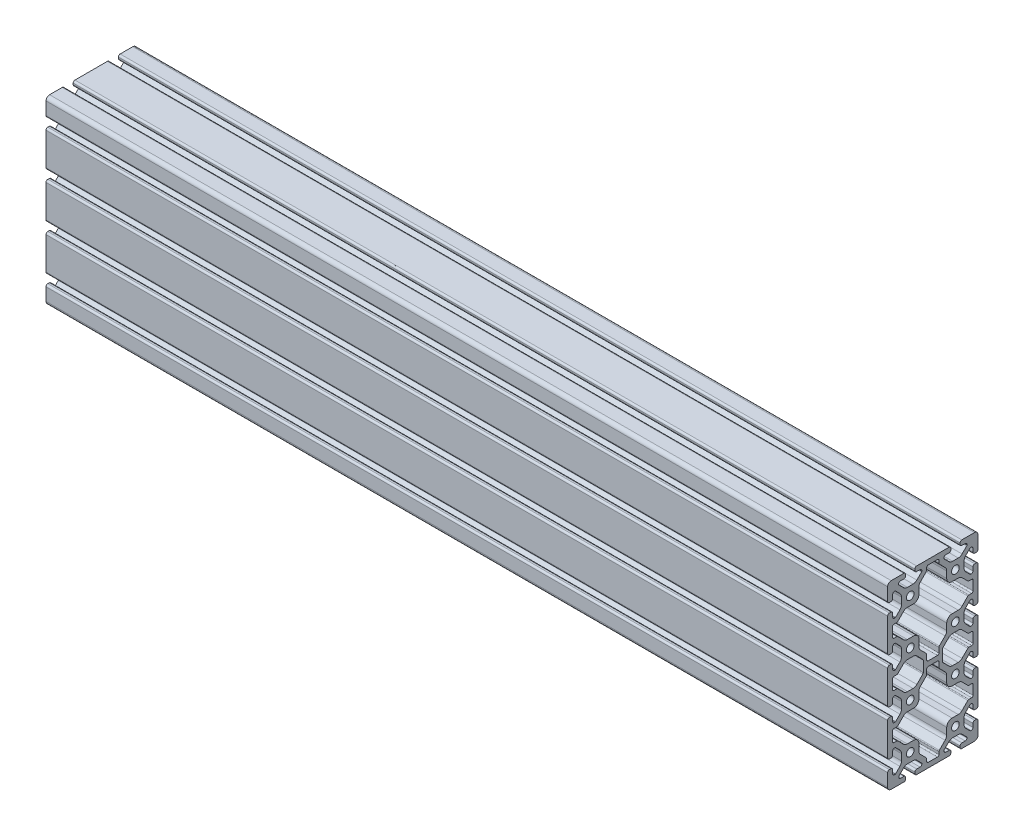
from build123d import *

# Parameters (mm, degrees)
SKETCH13_R              = 3.4
ALUMINUM_80X160_1_DEPTH = 745


with BuildPart() as part:
    # Sketch13 → Aluminum 80X160(1) (new body)
    with BuildSketch(Plane(origin=(0, 0, 0), x_dir=(0, 0, -1), z_dir=(1, 0, 0))):
        with BuildLine():
            Line((18.430000001, 115.93999946), (17.094615035, 115.93999946))
            ThreePointArc((17.094615035, 115.93999946), (15.984457388, 115.480157107), (15.524615035, 114.36999946))
            Line((15.524615035, 114.36999946), (15.524615035, 111.28499946))
            ThreePointArc((15.524615035, 111.28499946), (15.064772681, 110.174841814), (13.954615035, 109.71499946))
            Line((13.954615035, 109.71499946), (13.492503603, 109.71499946))
            ThreePointArc((13.492503603, 109.71499946), (13.201664018, 109.772851089), (12.955102179, 109.937598577))
            Line((12.955102179, 109.937598577), (9.109794089, 113.782907207))
            ThreePointArc((9.109794089, 113.782907207), (8.05529192, 115.36108123), (7.685000001, 117.222664418))
            Line((7.685000001, 117.222664418), (7.685000001, 122.777335582))
            ThreePointArc((7.685000001, 122.777335582), (8.05529192, 124.63891877), (9.109794089, 126.217092793))
            Line((9.109794089, 126.217092793), (12.955099454, 130.062404149))
            ThreePointArc((12.955099454, 130.062404149), (13.201662574, 130.227152355), (13.492503603, 130.285004232))
            Line((13.492503603, 130.285004232), (13.954615035, 130.285004232))
            ThreePointArc((13.954615035, 130.285004232), (15.064772681, 129.825161878), (15.524615035, 128.715004232))
            Line((15.524615035, 128.715004232), (15.524615035, 125.630004232))
            ThreePointArc((15.524615035, 125.630004232), (15.984457388, 124.519846585), (17.094615035, 124.060004232))
            Line((17.094615035, 124.060004232), (18.430000001, 124.060004232))
            ThreePointArc((18.430000001, 124.060004232), (19.540157647, 124.519846585), (20.000000001, 125.630004232))
            Line((20.000000001, 125.630004232), (20.000000001, 136.830003701))
            ThreePointArc((20.000000001, 136.830003701), (19.0715285, 139.07153219), (16.830000011, 140.000003691))
            Line((16.830000011, 140.000003691), (5.630000542, 140.000003691))
            ThreePointArc((5.630000542, 140.000003691), (4.519842916, 139.540161346), (4.060000572, 138.43000372))
            Line((4.060000572, 138.43000372), (4.060000572, 137.24999997))
            ThreePointArc((4.060000572, 137.24999997), (4.519842916, 136.139842345), (5.630000542, 135.68))
            Line((5.630000542, 135.68), (8.715399492, 135.68))
            ThreePointArc((8.715399492, 135.68), (9.825557139, 135.220157646), (10.285399492, 134.11))
            Line((10.285399492, 134.11), (10.285399492, 133.6200547))
            ThreePointArc((10.285399492, 133.6200547), (10.160433474, 133.35903797), (9.946956002, 133.163657296))
            Line((9.946956002, 133.163657296), (5.859541495, 129.076242789))
            ThreePointArc((5.859541495, 129.076242789), (4.318530588, 128.04657222), (2.500784284, 127.685))
            Line((2.500784284, 127.685), (-2.500784284, 127.685))
            ThreePointArc((-2.500784284, 127.685), (-4.318530588, 128.04657222), (-5.859541495, 129.076242789))
            Line((-5.859541495, 129.076242789), (-10.062800646, 133.27950194))
            ThreePointArc((-10.062800646, 133.27950194), (-10.227547937, 133.526063686), (-10.285399492, 133.816903094))
            Line((-10.285399492, 133.816903094), (-10.285398948, 134.11))
            ThreePointArc((-10.285398948, 134.11), (-9.825556595, 135.220157646), (-8.715398948, 135.68))
            Line((-8.715398948, 135.68), (-5.629999998, 135.68))
            ThreePointArc((-5.629999998, 135.68), (-4.519842372, 136.139842345), (-4.060000027, 137.24999997))
            Line((-4.060000027, 137.24999997), (-4.060000027, 138.43000372))
            ThreePointArc((-4.060000027, 138.43000372), (-4.519842372, 139.540161346), (-5.629999998, 140.000003691))
            Line((-5.629999998, 140.000003691), (-34.369999458, 140.000003691))
            ThreePointArc((-34.369999458, 140.000003691), (-35.480157084, 139.540161346), (-35.939999428, 138.43000372))
            Line((-35.939999428, 138.43000372), (-35.939999428, 137.24999997))
            ThreePointArc((-35.939999428, 137.24999997), (-35.480157084, 136.139842345), (-34.369999458, 135.68))
            Line((-34.369999458, 135.68), (-31.284600508, 135.68))
            ThreePointArc((-31.284600508, 135.68), (-30.174442861, 135.220157646), (-29.714600508, 134.11))
            Line((-29.714600508, 134.11), (-29.714600508, 133.6200547))
            ThreePointArc((-29.714600508, 133.6200547), (-29.839566526, 133.35903797), (-30.053043999, 133.163657296))
            Line((-30.053043999, 133.163657296), (-34.140458506, 129.076242789))
            ThreePointArc((-34.140458506, 129.076242789), (-35.681469413, 128.04657222), (-37.499215716, 127.685))
            Line((-37.499215716, 127.685), (-42.500784283, 127.685))
            ThreePointArc((-42.500784283, 127.685), (-44.318530587, 128.04657222), (-45.859541494, 129.076242789))
            Line((-45.859541494, 129.076242789), (-50.062800921, 133.279501665))
            ThreePointArc((-50.062800921, 133.279501665), (-50.227548408, 133.526063507), (-50.285400035, 133.816903094))
            Line((-50.285400035, 133.816903094), (-50.285399491, 134.11))
            ThreePointArc((-50.285399491, 134.11), (-49.825557138, 135.220157646), (-48.715399491, 135.68))
            Line((-48.715399491, 135.68), (-45.630000541, 135.68))
            ThreePointArc((-45.630000541, 135.68), (-44.519842915, 136.139842345), (-44.06000057, 137.24999997))
            Line((-44.06000057, 137.24999997), (-44.06000057, 138.43000372))
            ThreePointArc((-44.06000057, 138.43000372), (-44.519842915, 139.540161346), (-45.630000541, 140.000003691))
            Line((-45.630000541, 140.000003691), (-56.83000001, 140.000003691))
            ThreePointArc((-56.83000001, 140.000003691), (-59.071528499, 139.07153219), (-60, 136.830003701))
            Line((-60, 136.830003701), (-60, 125.630004232))
            ThreePointArc((-60, 125.630004232), (-59.540157646, 124.519846585), (-58.43, 124.060004232))
            Line((-58.43, 124.060004232), (-57.094615034, 124.060004232))
            ThreePointArc((-57.094615034, 124.060004232), (-55.984457387, 124.519846585), (-55.524615034, 125.630004232))
            Line((-55.524615034, 125.630004232), (-55.524615034, 128.715004232))
            ThreePointArc((-55.524615034, 128.715004232), (-55.06477268, 129.825161878), (-53.954615034, 130.285004232))
            Line((-53.954615034, 130.285004232), (-53.492503602, 130.285004232))
            ThreePointArc((-53.492503602, 130.285004232), (-53.201662569, 130.227152353), (-52.955099446, 130.062404142))
            Line((-52.955099446, 130.062404142), (-49.109794081, 126.217092786))
            ThreePointArc((-49.109794081, 126.217092786), (-48.055291917, 124.638918766), (-47.685, 122.777335582))
            Line((-47.685, 122.777335582), (-47.685, 117.222664418))
            ThreePointArc((-47.685, 117.222664418), (-48.055291992, 115.361081053), (-49.109794358, 113.782906937))
            Line((-49.109794358, 113.782906937), (-52.955102448, 109.937598306))
            ThreePointArc((-52.955102448, 109.937598306), (-53.201664193, 109.772851015), (-53.492503602, 109.71499946))
            Line((-53.492503602, 109.71499946), (-53.954615034, 109.71499946))
            ThreePointArc((-53.954615034, 109.71499946), (-55.06477268, 110.174841814), (-55.524615034, 111.28499946))
            Line((-55.524615034, 111.28499946), (-55.524615034, 114.36999946))
            ThreePointArc((-55.524615034, 114.36999946), (-55.984457387, 115.480157107), (-57.094615034, 115.93999946))
            Line((-57.094615034, 115.93999946), (-58.43, 115.93999946))
            ThreePointArc((-58.43, 115.93999946), (-59.540157646, 115.480157107), (-60, 114.36999946))
            Line((-60, 114.36999946), (-60, 85.63))
            ThreePointArc((-60, 85.63), (-59.540157646, 84.519842353), (-58.43, 84.06))
            Line((-58.43, 84.06), (-57.094615034, 84.06))
            ThreePointArc((-57.094615034, 84.06), (-55.984457387, 84.519842353), (-55.524615034, 85.63))
            Line((-55.524615034, 85.63), (-55.524615034, 88.715))
            ThreePointArc((-55.524615034, 88.715), (-55.06477268, 89.825157646), (-53.954615034, 90.285))
            Line((-53.954615034, 90.285), (-53.492503602, 90.285))
            ThreePointArc((-53.492503602, 90.285), (-53.201664193, 90.227148444), (-52.955102448, 90.062401153))
            Line((-52.955102448, 90.062401153), (-49.109794088, 86.217092793))
            ThreePointArc((-49.109794088, 86.217092793), (-48.055291919, 84.63891877), (-47.685, 82.777335582))
            Line((-47.685, 82.777335582), (-47.685, 77.222664417))
            ThreePointArc((-47.685, 77.222664417), (-48.055291919, 75.361081229), (-49.109794088, 73.782907207))
            Line((-49.109794088, 73.782907207), (-52.955102448, 69.937598846))
            ThreePointArc((-52.955102448, 69.937598846), (-53.201664193, 69.772851555), (-53.492503602, 69.715))
            Line((-53.492503602, 69.715), (-53.954615034, 69.715))
            ThreePointArc((-53.954615034, 69.715), (-55.06477268, 70.174842354), (-55.524615034, 71.285))
            Line((-55.524615034, 71.285), (-55.524615034, 74.37))
            ThreePointArc((-55.524615034, 74.37), (-55.984457387, 75.480157646), (-57.094615034, 75.94))
            Line((-57.094615034, 75.94), (-58.43, 75.94))
            ThreePointArc((-58.43, 75.94), (-59.540157646, 75.480157646), (-60, 74.37))
            Line((-60, 74.37), (-60, 45.63000054))
            ThreePointArc((-60, 45.63000054), (-59.540157646, 44.519842893), (-58.43, 44.06000054))
            Line((-58.43, 44.06000054), (-57.094615034, 44.06000054))
            ThreePointArc((-57.094615034, 44.06000054), (-55.984457387, 44.519842893), (-55.524615034, 45.63000054))
            Line((-55.524615034, 45.63000054), (-55.524615034, 48.715000539))
            ThreePointArc((-55.524615034, 48.715000539), (-55.06477268, 49.825158186), (-53.954615034, 50.285000539))
            Line((-53.954615034, 50.285000539), (-53.492503602, 50.285000539))
            ThreePointArc((-53.492503602, 50.285000539), (-53.201663987, 50.227148943), (-52.955102067, 50.062401535))
            Line((-52.955102067, 50.062401535), (-49.109794088, 46.217092793))
            ThreePointArc((-49.109794088, 46.217092793), (-48.055291919, 44.63891877), (-47.685, 42.777335582))
            Line((-47.685, 42.777335582), (-47.685, 37.222664417))
            ThreePointArc((-47.685, 37.222664417), (-48.055291919, 35.361081229), (-49.109794088, 33.782907206))
            Line((-49.109794088, 33.782907206), (-52.955102448, 29.937598846))
            ThreePointArc((-52.955102448, 29.937598846), (-53.201664193, 29.772851555), (-53.492503602, 29.715))
            Line((-53.492503602, 29.715), (-53.954615034, 29.715))
            ThreePointArc((-53.954615034, 29.715), (-55.06477268, 30.174842353), (-55.524615034, 31.285))
            Line((-55.524615034, 31.285), (-55.524615034, 34.37))
            ThreePointArc((-55.524615034, 34.37), (-55.984457387, 35.480157646), (-57.094615034, 35.94))
            Line((-57.094615034, 35.94), (-58.43, 35.94))
            ThreePointArc((-58.43, 35.94), (-59.540157646, 35.480157646), (-60, 34.37))
            Line((-60, 34.37), (-60, 5.630000539))
            ThreePointArc((-60, 5.630000539), (-59.540157646, 4.519842893), (-58.43, 4.060000539))
            Line((-58.43, 4.060000539), (-57.094615034, 4.060000539))
            ThreePointArc((-57.094615034, 4.060000539), (-55.984457387, 4.519842893), (-55.524615034, 5.630000539))
            Line((-55.524615034, 5.630000539), (-55.524615034, 8.715000539))
            ThreePointArc((-55.524615034, 8.715000539), (-55.06477268, 9.825158186), (-53.954615034, 10.285000539))
            Line((-53.954615034, 10.285000539), (-53.492503602, 10.285000539))
            ThreePointArc((-53.492503602, 10.285000539), (-53.201662345, 10.227148616), (-52.955099032, 10.062400278))
            Line((-52.955099032, 10.062400278), (-49.109791942, 6.217090648))
            ThreePointArc((-49.109791942, 6.217090648), (-48.055291338, 4.638917369), (-47.685, 2.777335582))
            Line((-47.685, 2.777335582), (-47.685, -2.777335582))
            ThreePointArc((-47.685, -2.777335582), (-48.055292499, -4.638920172), (-49.109796234, -6.217094939))
            Line((-49.109796234, -6.217094939), (-52.955102448, -10.062405445))
            ThreePointArc((-52.955102448, -10.062405445), (-53.201664193, -10.227152736), (-53.492503602, -10.285004291))
            Line((-53.492503602, -10.285004291), (-53.954615034, -10.285004291))
            ThreePointArc((-53.954615034, -10.285004291), (-55.06477268, -9.825161938), (-55.524615034, -8.715004291))
            Line((-55.524615034, -8.715004291), (-55.524615034, -5.630004291))
            ThreePointArc((-55.524615034, -5.630004291), (-55.984457387, -4.519846645), (-57.094615034, -4.060004291))
            Line((-57.094615034, -4.060004291), (-58.43, -4.060004291))
            ThreePointArc((-58.43, -4.060004291), (-59.540157646, -4.519846645), (-60, -5.630004291))
            Line((-60, -5.630004291), (-60, -16.83000376))
            ThreePointArc((-60, -16.83000376), (-59.071528499, -19.07153225), (-56.83000001, -20.00000375))
            Line((-56.83000001, -20.00000375), (-45.572979047, -20.00000375))
            ThreePointArc((-45.572979047, -20.00000375), (-44.4628214, -19.540161397), (-44.002979047, -18.43000375))
            Line((-44.002979047, -18.43000375), (-44.002979047, -17.25))
            ThreePointArc((-44.002979047, -17.25), (-44.4628214, -16.139842354), (-45.572979047, -15.68))
            Line((-45.572979047, -15.68), (-48.475666995, -15.68))
            ThreePointArc((-48.475666995, -15.68), (-49.605030481, -15.200613642), (-50.044710593, -14.05520779))
            Line((-50.044710593, -14.05520779), (-50.033001359, -13.71989919))
            ThreePointArc((-50.033001359, -13.71989919), (-50.01272935, -13.354224617), (-49.823787839, -13.040489134))
            Line((-49.823787839, -13.040489134), (-45.859541494, -9.076242789))
            ThreePointArc((-45.859541494, -9.076242789), (-44.318530587, -8.046572221), (-42.500784283, -7.685))
            Line((-42.500784283, -7.685), (-37.499215716, -7.685))
            ThreePointArc((-37.499215716, -7.685), (-35.681469412, -8.046572221), (-34.140458505, -9.076242789))
            Line((-34.140458505, -9.076242789), (-29.937199354, -13.279501941))
            ThreePointArc((-29.937199354, -13.279501941), (-29.772452063, -13.526063686), (-29.714600508, -13.816903094))
            Line((-29.714600508, -13.816903094), (-29.714600508, -14.11))
            ThreePointArc((-29.714600508, -14.11), (-30.174442861, -15.220157647), (-31.284600508, -15.68))
            Line((-31.284600508, -15.68), (-34.242079997, -15.68))
            ThreePointArc((-34.242079997, -15.68), (-35.396115236, -16.115290279), (-35.879549627, -17.25))
            Line((-35.879549627, -17.25), (-35.879549627, -18.43000375))
            ThreePointArc((-35.879549627, -18.43000375), (-35.396115236, -19.564713471), (-34.242079997, -20.00000375))
            Line((-34.242079997, -20.00000375), (-5.572979047, -20.00000375))
            ThreePointArc((-5.572979047, -20.00000375), (-4.4628214, -19.540161397), (-4.002979047, -18.43000375))
            Line((-4.002979047, -18.43000375), (-4.002979047, -17.25))
            ThreePointArc((-4.002979047, -17.25), (-4.4628214, -16.139842354), (-5.572979047, -15.68))
            Line((-5.572979047, -15.68), (-8.475666995, -15.68))
            ThreePointArc((-8.475666995, -15.68), (-9.605030481, -15.200613642), (-10.044710593, -14.05520779))
            Line((-10.044710593, -14.05520779), (-10.033001359, -13.71989919))
            ThreePointArc((-10.033001359, -13.71989919), (-10.01272935, -13.354224617), (-9.823787839, -13.040489134))
            Line((-9.823787839, -13.040489134), (-5.859541494, -9.076242789))
            ThreePointArc((-5.859541494, -9.076242789), (-4.318530587, -8.046572221), (-2.500784283, -7.685))
            Line((-2.500784283, -7.685), (2.500784284, -7.685))
            ThreePointArc((2.500784284, -7.685), (4.318530588, -8.046572221), (5.859541495, -9.076242789))
            Line((5.859541495, -9.076242789), (10.062800646, -13.279501941))
            ThreePointArc((10.062800646, -13.279501941), (10.227547937, -13.526063686), (10.285399492, -13.816903094))
            Line((10.285399492, -13.816903094), (10.285399492, -14.11))
            ThreePointArc((10.285399492, -14.11), (9.825557139, -15.220157647), (8.715399492, -15.68))
            Line((8.715399492, -15.68), (5.757920003, -15.68))
            ThreePointArc((5.757920003, -15.68), (4.604217926, -16.116685586), (4.12044985, -17.251450422))
            Line((4.12044985, -17.251450422), (4.12044985, -18.431454172))
            ThreePointArc((4.12044985, -18.431454172), (4.604408447, -19.565215201), (5.757920003, -20.00000375))
            Line((5.757920003, -20.00000375), (17.018369329, -20.00000375))
            ThreePointArc((17.018369329, -20.00000375), (19.194276186, -18.951580404), (20.000000001, -16.674615034))
            Line((20.000000001, -16.674615034), (20.000000001, -5.630004291))
            ThreePointArc((20.000000001, -5.630004291), (19.540157647, -4.519846645), (18.430000001, -4.060004291))
            Line((18.430000001, -4.060004291), (17.094615035, -4.060004291))
            ThreePointArc((17.094615035, -4.060004291), (15.984457388, -4.519846645), (15.524615035, -5.630004291))
            Line((15.524615035, -5.630004291), (15.524615035, -8.715004291))
            ThreePointArc((15.524615035, -8.715004291), (15.064772681, -9.825161938), (13.954615035, -10.285004291))
            Line((13.954615035, -10.285004291), (13.492503603, -10.285004291))
            ThreePointArc((13.492503603, -10.285004291), (13.201662793, -10.227152155), (12.955100304, -10.062403299))
            Line((12.955100304, -10.062403299), (9.109794089, -6.217092793))
            ThreePointArc((9.109794089, -6.217092793), (8.05529192, -4.63891877), (7.685000001, -2.777335582))
            Line((7.685000001, -2.777335582), (7.685000001, 2.777335582))
            ThreePointArc((7.685000001, 2.777335582), (8.05529192, 4.63891877), (9.109794089, 6.217092793))
            Line((9.109794089, 6.217092793), (12.955101179, 10.062402423))
            ThreePointArc((12.955101179, 10.062402423), (13.201663747, 10.227149197), (13.492503603, 10.285000539))
            Line((13.492503603, 10.285000539), (13.954615035, 10.285000539))
            ThreePointArc((13.954615035, 10.285000539), (15.064772681, 9.825158186), (15.524615035, 8.715000539))
            Line((15.524615035, 8.715000539), (15.524615035, 5.630000539))
            ThreePointArc((15.524615035, 5.630000539), (15.984457388, 4.519842893), (17.094615035, 4.060000539))
            Line((17.094615035, 4.060000539), (18.430000001, 4.060000539))
            ThreePointArc((18.430000001, 4.060000539), (19.540157647, 4.519842893), (20.000000001, 5.630000539))
            Line((20.000000001, 5.630000539), (20.000000001, 34.37))
            ThreePointArc((20.000000001, 34.37), (19.540157647, 35.480157646), (18.430000001, 35.94))
            Line((18.430000001, 35.94), (17.094615035, 35.94))
            ThreePointArc((17.094615035, 35.94), (15.984457388, 35.480157646), (15.524615035, 34.37))
            Line((15.524615035, 34.37), (15.524615035, 31.285))
            ThreePointArc((15.524615035, 31.285), (15.064772681, 30.174842353), (13.954615035, 29.715))
            Line((13.954615035, 29.715), (13.492503603, 29.715))
            ThreePointArc((13.492503603, 29.715), (13.201664194, 29.772851555), (12.955102449, 29.937598846))
            Line((12.955102449, 29.937598846), (9.109794089, 33.782907206))
            ThreePointArc((9.109794089, 33.782907206), (8.05529192, 35.361081229), (7.685000001, 37.222664417))
            Line((7.685000001, 37.222664417), (7.685000001, 42.777335582))
            ThreePointArc((7.685000001, 42.777335582), (8.05529192, 44.638918771), (9.109794089, 46.217092794))
            Line((9.109794089, 46.217092794), (12.955102068, 50.062401536))
            ThreePointArc((12.955102068, 50.062401536), (13.201663988, 50.227148943), (13.492503603, 50.285000539))
            Line((13.492503603, 50.285000539), (13.954615035, 50.285000539))
            ThreePointArc((13.954615035, 50.285000539), (15.064772681, 49.825158186), (15.524615035, 48.715000539))
            Line((15.524615035, 48.715000539), (15.524615035, 45.63000054))
            ThreePointArc((15.524615035, 45.63000054), (15.984457388, 44.519842893), (17.094615035, 44.06000054))
            Line((17.094615035, 44.06000054), (18.430000001, 44.06000054))
            ThreePointArc((18.430000001, 44.06000054), (19.540157647, 44.519842893), (20.000000001, 45.63000054))
            Line((20.000000001, 45.63000054), (20.000000001, 74.37))
            ThreePointArc((20.000000001, 74.37), (19.540157647, 75.480157646), (18.430000001, 75.94))
            Line((18.430000001, 75.94), (17.094615035, 75.94))
            ThreePointArc((17.094615035, 75.94), (15.984457388, 75.480157646), (15.524615035, 74.37))
            Line((15.524615035, 74.37), (15.524615035, 71.285))
            ThreePointArc((15.524615035, 71.285), (15.064772681, 70.174842354), (13.954615035, 69.715))
            Line((13.954615035, 69.715), (13.492503603, 69.715))
            ThreePointArc((13.492503603, 69.715), (13.201664195, 69.772851555), (12.95510245, 69.937598846))
            Line((12.95510245, 69.937598846), (9.109794089, 73.782907205))
            ThreePointArc((9.109794089, 73.782907205), (8.05529192, 75.361081229), (7.685000001, 77.222664417))
            Line((7.685000001, 77.222664417), (7.685000001, 82.777335582))
            ThreePointArc((7.685000001, 82.777335582), (8.05529192, 84.63891877), (9.109794089, 86.217092793))
            Line((9.109794089, 86.217092793), (12.955102449, 90.062401153))
            ThreePointArc((12.955102449, 90.062401153), (13.201664194, 90.227148444), (13.492503603, 90.285))
            Line((13.492503603, 90.285), (13.954615035, 90.285))
            ThreePointArc((13.954615035, 90.285), (15.064772681, 89.825157646), (15.524615035, 88.715))
            Line((15.524615035, 88.715), (15.524615035, 85.63))
            ThreePointArc((15.524615035, 85.63), (15.984457388, 84.519842353), (17.094615035, 84.06))
            Line((17.094615035, 84.06), (18.430000001, 84.06))
            ThreePointArc((18.430000001, 84.06), (19.540157647, 84.519842353), (20.000000001, 85.63))
            Line((20.000000001, 85.63), (20.000000001, 114.36999946))
            ThreePointArc((20.000000001, 114.36999946), (19.540157647, 115.480157107), (18.430000001, 115.93999946))
        make_face()
        with Locations((-40, 40)):
            Circle(SKETCH13_R, mode=Mode.SUBTRACT)
        with Locations((0, 40)):
            Circle(SKETCH13_R, mode=Mode.SUBTRACT)
        with Locations((-40, 120)):
            Circle(SKETCH13_R, mode=Mode.SUBTRACT)
        with Locations((0, 120)):
            Circle(SKETCH13_R, mode=Mode.SUBTRACT)
        with Locations((0, 80)):
            Circle(SKETCH13_R, mode=Mode.SUBTRACT)
        with Locations((-40, 80)):
            Circle(SKETCH13_R, mode=Mode.SUBTRACT)
        Circle(SKETCH13_R, mode=Mode.SUBTRACT)
        with Locations((-40, 0)):
            Circle(SKETCH13_R, mode=Mode.SUBTRACT)
        with BuildLine():
            Line((-24.129999999, 57.84), (-15.87, 57.84))
            ThreePointArc((-15.87, 57.84), (-14.971974388, 57.468025612), (-14.6, 56.57))
            Line((-14.6, 56.57), (-14.6, 52.233349929))
            ThreePointArc((-14.6, 52.233349929), (-14.503327006, 51.74734197), (-14.228025612, 51.335324317))
            Line((-14.228025612, 51.335324317), (-9.109794088, 46.217092793))
            ThreePointArc((-9.109794088, 46.217092793), (-8.055291919, 44.63891877), (-7.685, 42.777335582))
            Line((-7.685, 42.777335582), (-7.685, 37.065))
            ThreePointArc((-7.685, 37.065), (-6.293757211, 33.706242789), (-2.935, 32.315))
            Line((-2.935, 32.315), (2.500784284, 32.315))
            ThreePointArc((2.500784284, 32.315), (4.318530588, 31.953427779), (5.859541495, 30.923757211))
            Line((5.859541495, 30.923757211), (11.011324318, 25.771974388))
            ThreePointArc((11.011324318, 25.771974388), (11.423341971, 25.496672994), (11.90934993, 25.4))
            Line((11.90934993, 25.4), (14.41, 25.4))
            ThreePointArc((14.41, 25.4), (15.308025612, 25.028025612), (15.68, 24.13))
            Line((15.68, 24.13), (15.68, 15.87))
            ThreePointArc((15.68, 15.87), (15.308025612, 14.971974387), (14.41, 14.599999999))
            Line((14.41, 14.599999999), (11.909349929, 14.599999999))
            ThreePointArc((11.909349929, 14.599999999), (11.423341971, 14.503327006), (11.011324318, 14.228025612))
            Line((11.011324318, 14.228025612), (5.859541495, 9.076242789))
            ThreePointArc((5.859541495, 9.076242789), (4.318530588, 8.046572221), (2.500784284, 7.685))
            Line((2.500784284, 7.685), (-2.935, 7.685))
            ThreePointArc((-2.935, 7.685), (-6.293757211, 6.293757211), (-7.685, 2.935))
            Line((-7.685, 2.935), (-7.685, -2.777335582))
            ThreePointArc((-7.685, -2.777335582), (-8.055292426, -4.638919995), (-9.109795963, -6.217094668))
            Line((-9.109795963, -6.217094668), (-14.228025612, -11.335328067))
            ThreePointArc((-14.228025612, -11.335328067), (-14.503327006, -11.74734572), (-14.6, -12.23335368))
            Line((-14.6, -12.23335368), (-14.6, -14.41))
            ThreePointArc((-14.6, -14.41), (-14.971974388, -15.308025612), (-15.87, -15.68))
            Line((-15.87, -15.68), (-24.129999999, -15.68))
            ThreePointArc((-24.129999999, -15.68), (-25.028025611, -15.308025612), (-25.399999999, -14.41))
            Line((-25.399999999, -14.41), (-25.399999999, -12.23335368))
            ThreePointArc((-25.399999999, -12.23335368), (-25.4966735, -11.747344495), (-25.771976262, -11.335326192))
            Line((-25.771976262, -11.335326192), (-30.890205911, -6.217092793))
            ThreePointArc((-30.890205911, -6.217092793), (-31.94470808, -4.63891877), (-32.314999999, -2.777335582))
            Line((-32.314999999, -2.777335582), (-32.314999999, 2.935))
            ThreePointArc((-32.314999999, 2.935), (-33.706242788, 6.293757211), (-37.064999999, 7.685))
            Line((-37.064999999, 7.685), (-42.500784283, 7.685))
            ThreePointArc((-42.500784283, 7.685), (-44.318530587, 8.046572221), (-45.859541494, 9.076242789))
            Line((-45.859541494, 9.076242789), (-51.011324317, 14.228025612))
            ThreePointArc((-51.011324317, 14.228025612), (-51.42334197, 14.503327006), (-51.909349929, 14.599999999))
            Line((-51.909349929, 14.599999999), (-54.41, 14.599999999))
            ThreePointArc((-54.41, 14.599999999), (-55.308025612, 14.971974387), (-55.68, 15.87))
            Line((-55.68, 15.87), (-55.68, 24.129999999))
            ThreePointArc((-55.68, 24.129999999), (-55.308025612, 25.028025612), (-54.41, 25.4))
            Line((-54.41, 25.4), (-51.909349929, 25.4))
            ThreePointArc((-51.909349929, 25.4), (-51.42334197, 25.496672994), (-51.011324317, 25.771974387))
            Line((-51.011324317, 25.771974387), (-45.859541494, 30.92375721))
            ThreePointArc((-45.859541494, 30.92375721), (-44.318530588, 31.953427779), (-42.500784284, 32.315))
            Line((-42.500784284, 32.315), (-37.064999999, 32.315))
            ThreePointArc((-37.064999999, 32.315), (-33.706242789, 33.706242789), (-32.314999999, 37.065))
            Line((-32.314999999, 37.065), (-32.314999999, 42.777335582))
            ThreePointArc((-32.314999999, 42.777335582), (-31.94470808, 44.63891877), (-30.890205911, 46.217092793))
            Line((-30.890205911, 46.217092793), (-25.771974387, 51.335324317))
            ThreePointArc((-25.771974387, 51.335324317), (-25.496672993, 51.74734197), (-25.399999999, 52.233349929))
            Line((-25.399999999, 52.233349929), (-25.399999999, 56.57))
            ThreePointArc((-25.399999999, 56.57), (-25.028025611, 57.468025612), (-24.129999999, 57.84))
        make_face(mode=Mode.SUBTRACT)
        with BuildLine():
            Line((-28.801974388, 54.414726906), (-34.140458505, 49.076242789))
            ThreePointArc((-34.140458505, 49.076242789), (-35.681469412, 48.04657222), (-37.499215716, 47.685))
            Line((-37.499215716, 47.685), (-42.500784283, 47.685))
            ThreePointArc((-42.500784283, 47.685), (-44.318530587, 48.04657222), (-45.859541494, 49.07624279))
            Line((-45.859541494, 49.07624279), (-51.011324317, 54.228025613))
            ThreePointArc((-51.011324317, 54.228025613), (-51.42334197, 54.503327007), (-51.909349929, 54.600000001))
            Line((-51.909349929, 54.600000001), (-54.41, 54.600000001))
            ThreePointArc((-54.41, 54.600000001), (-55.308025612, 54.971974388), (-55.68, 55.870000001))
            Line((-55.68, 55.870000001), (-55.68, 64.13))
            ThreePointArc((-55.68, 64.13), (-55.308025612, 65.028025612), (-54.41, 65.4))
            Line((-54.41, 65.4), (-51.909349929, 65.4))
            ThreePointArc((-51.909349929, 65.4), (-51.42334197, 65.496672994), (-51.011324317, 65.771974388))
            Line((-51.011324317, 65.771974388), (-45.859541494, 70.923757211))
            ThreePointArc((-45.859541494, 70.923757211), (-44.318530587, 71.953427779), (-42.500784283, 72.315))
            Line((-42.500784283, 72.315), (-37.499215716, 72.315))
            ThreePointArc((-37.499215716, 72.315), (-35.681469413, 71.95342778), (-34.140458506, 70.923757211))
            Line((-34.140458506, 70.923757211), (-28.801974388, 65.585273093))
            ThreePointArc((-28.801974388, 65.585273093), (-28.526672994, 65.17325544), (-28.430000001, 64.687247481))
            Line((-28.430000001, 64.687247481), (-28.43, 55.312752519))
            ThreePointArc((-28.43, 55.312752519), (-28.526672994, 54.826744559), (-28.801974388, 54.414726906))
        make_face(mode=Mode.SUBTRACT)
        with BuildLine():
            Line((-11.57, 55.312752519), (-11.57, 64.687247481))
            ThreePointArc((-11.57, 64.687247481), (-11.473327006, 65.17325544), (-11.198025612, 65.585273093))
            Line((-11.198025612, 65.585273093), (-5.859541494, 70.923757211))
            ThreePointArc((-5.859541494, 70.923757211), (-4.318530588, 71.95342778), (-2.500784284, 72.315))
            Line((-2.500784284, 72.315), (2.500784284, 72.315))
            ThreePointArc((2.500784284, 72.315), (4.318530588, 71.95342778), (5.859541495, 70.923757211))
            Line((5.859541495, 70.923757211), (11.011324318, 65.771974388))
            ThreePointArc((11.011324318, 65.771974388), (11.423341971, 65.496672994), (11.90934993, 65.4))
            Line((11.90934993, 65.4), (14.41, 65.4))
            ThreePointArc((14.41, 65.4), (15.308025612, 65.028025612), (15.68, 64.13))
            Line((15.68, 64.13), (15.68, 55.870000001))
            ThreePointArc((15.68, 55.870000001), (15.308025612, 54.971974388), (14.41, 54.600000001))
            Line((14.41, 54.600000001), (11.90934993, 54.600000001))
            ThreePointArc((11.90934993, 54.600000001), (11.423341971, 54.503327007), (11.011324318, 54.228025612))
            Line((11.011324318, 54.228025612), (5.859541495, 49.076242789))
            ThreePointArc((5.859541495, 49.076242789), (4.318530588, 48.04657222), (2.500784284, 47.685))
            Line((2.500784284, 47.685), (-2.500784284, 47.685))
            ThreePointArc((-2.500784284, 47.685), (-4.318530588, 48.04657222), (-5.859541495, 49.076242789))
            Line((-5.859541495, 49.076242789), (-11.198025612, 54.414726907))
            ThreePointArc((-11.198025612, 54.414726907), (-11.473327006, 54.82674456), (-11.57, 55.312752519))
        make_face(mode=Mode.SUBTRACT)
        with BuildLine():
            Line((-15.87, 62.16), (-24.129999999, 62.16))
            ThreePointArc((-24.129999999, 62.16), (-25.028025611, 62.531974388), (-25.399999999, 63.43))
            Line((-25.399999999, 63.43), (-25.399999999, 67.76665007))
            ThreePointArc((-25.399999999, 67.76665007), (-25.496672993, 68.252658029), (-25.771974387, 68.664675682))
            Line((-25.771974387, 68.664675682), (-30.890205911, 73.782907206))
            ThreePointArc((-30.890205911, 73.782907206), (-31.94470808, 75.361081229), (-32.314999999, 77.222664417))
            Line((-32.314999999, 77.222664417), (-32.314999999, 82.935))
            ThreePointArc((-32.314999999, 82.935), (-33.706242788, 86.29375721), (-37.064999999, 87.685))
            Line((-37.064999999, 87.685), (-42.500784284, 87.685))
            ThreePointArc((-42.500784284, 87.685), (-44.318530587, 88.04657222), (-45.859541494, 89.076242789))
            Line((-45.859541494, 89.076242789), (-51.011324317, 94.228025612))
            ThreePointArc((-51.011324317, 94.228025612), (-51.42334197, 94.503327006), (-51.909349929, 94.6))
            Line((-51.909349929, 94.6), (-54.41, 94.6))
            ThreePointArc((-54.41, 94.6), (-55.308025612, 94.971974387), (-55.68, 95.87))
            Line((-55.68, 95.87), (-55.68, 104.129999999))
            ThreePointArc((-55.68, 104.129999999), (-55.308025612, 105.028025612), (-54.41, 105.4))
            Line((-54.41, 105.4), (-51.909349929, 105.4))
            ThreePointArc((-51.909349929, 105.4), (-51.42334197, 105.496672994), (-51.011324317, 105.771974388))
            Line((-51.011324317, 105.771974388), (-45.859541494, 110.923757211))
            ThreePointArc((-45.859541494, 110.923757211), (-44.318530587, 111.953427779), (-42.500784283, 112.315))
            Line((-42.500784283, 112.315), (-37.064999999, 112.315))
            ThreePointArc((-37.064999999, 112.315), (-33.706242788, 113.706242789), (-32.314999999, 117.065))
            Line((-32.314999999, 117.065), (-32.314999999, 122.777335582))
            ThreePointArc((-32.314999999, 122.777335582), (-31.94470808, 124.63891877), (-30.890205911, 126.217092793))
            Line((-30.890205911, 126.217092793), (-25.771976262, 131.335326192))
            ThreePointArc((-25.771976262, 131.335326192), (-25.4966735, 131.747344495), (-25.399999999, 132.233353679))
            Line((-25.399999999, 132.233353679), (-25.399999999, 134.41))
            ThreePointArc((-25.399999999, 134.41), (-25.028025611, 135.308025612), (-24.129999999, 135.68))
            Line((-24.129999999, 135.68), (-15.87, 135.68))
            ThreePointArc((-15.87, 135.68), (-14.971974388, 135.308025612), (-14.6, 134.41))
            Line((-14.6, 134.41), (-14.6, 132.233353679))
            ThreePointArc((-14.6, 132.233353679), (-14.503327006, 131.74734572), (-14.228025612, 131.335328067))
            Line((-14.228025612, 131.335328067), (-9.109795963, 126.217094668))
            ThreePointArc((-9.109795963, 126.217094668), (-8.055292426, 124.638919995), (-7.685, 122.777335582))
            Line((-7.685, 122.777335582), (-7.685, 117.065))
            ThreePointArc((-7.685, 117.065), (-6.293757211, 113.706242789), (-2.935, 112.315))
            Line((-2.935, 112.315), (2.500784284, 112.315))
            ThreePointArc((2.500784284, 112.315), (4.318530588, 111.953427779), (5.859541495, 110.923757211))
            Line((5.859541495, 110.923757211), (11.011324317, 105.771974388))
            ThreePointArc((11.011324317, 105.771974388), (11.42334197, 105.496672994), (11.909349929, 105.4))
            Line((11.909349929, 105.4), (14.41, 105.4))
            ThreePointArc((14.41, 105.4), (15.308025612, 105.028025612), (15.68, 104.129999999))
            Line((15.68, 104.129999999), (15.68, 95.87))
            ThreePointArc((15.68, 95.87), (15.308025612, 94.971974388), (14.41, 94.6))
            Line((14.41, 94.6), (11.90934993, 94.6))
            ThreePointArc((11.90934993, 94.6), (11.423341971, 94.503327006), (11.011324318, 94.228025612))
            Line((11.011324318, 94.228025612), (5.859541495, 89.076242789))
            ThreePointArc((5.859541495, 89.076242789), (4.318530588, 88.04657222), (2.500784284, 87.685))
            Line((2.500784284, 87.685), (-2.935, 87.685))
            ThreePointArc((-2.935, 87.685), (-6.293757211, 86.29375721), (-7.685, 82.935))
            Line((-7.685, 82.935), (-7.685, 77.222664417))
            ThreePointArc((-7.685, 77.222664417), (-8.055291919, 75.361081229), (-9.109794088, 73.782907206))
            Line((-9.109794088, 73.782907206), (-14.228025612, 68.664675682))
            ThreePointArc((-14.228025612, 68.664675682), (-14.503327006, 68.252658029), (-14.6, 67.76665007))
            Line((-14.6, 67.76665007), (-14.6, 63.43))
            ThreePointArc((-14.6, 63.43), (-14.971974388, 62.531974388), (-15.87, 62.16))
        make_face(mode=Mode.SUBTRACT)
    extrude(amount=ALUMINUM_80X160_1_DEPTH)


solid = part.part
